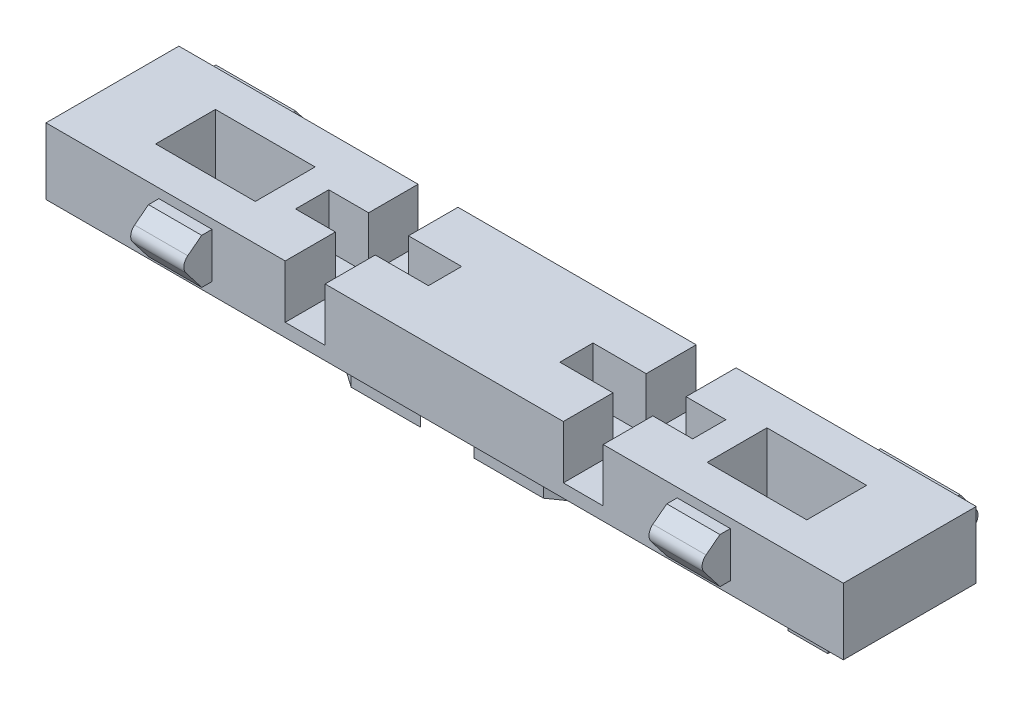
from build123d import *

# Parameters (mm, degrees)
SKETCH2_W             = 60
SKETCH2_H             = 10
SKETCH2_W_2           = 7.5
SKETCH2_H_2           = 4.5
BOSS_EXTRUDE2_DEPTH   = 5
BOSS_EXTRUDE5_DEPTH   = 60
BOSS_EXTRUDE5_2_DEPTH = 60
SKETCH7_W             = 2
SKETCH7_H             = 5
SKETCH7_W_2           = 44
CUT_EXTRUDE1_DEPTH    = 13
SKETCH8_W             = 8.5
SKETCH8_H             = 5
SKETCH8_W_2           = 35
CUT_EXTRUDE2_DEPTH    = 13
CUT_EXTRUDE3_DEPTH    = 4
CUT_EXTRUDE4_DEPTH    = 4
SKETCH11_W            = 2.607558909
SKETCH11_H            = 2.607558909
SKETCH11_W_2          = 3
SKETCH11_H_2          = 3
BOSS_EXTRUDE6_DEPTH   = 1


with BuildPart() as part:
    # Sketch2 → Boss-Extrude2 (new body)
    with BuildSketch(Plane(origin=(0, 0, 0), x_dir=(1, 0, 0), z_dir=(0, 1, 0))):
        Rectangle(SKETCH2_W, SKETCH2_H)
        with Locations((-20.75, 0)):
            Rectangle(SKETCH2_W_2, SKETCH2_H_2, mode=Mode.SUBTRACT)
        with Locations((20.75, 0)):
            Rectangle(SKETCH2_W_2, SKETCH2_H_2, mode=Mode.SUBTRACT)
    extrude(amount=BOSS_EXTRUDE2_DEPTH)

    # Sketch9 → Cut-Extrude3 (cut)
    with BuildSketch(Plane(origin=(0, 5, 0), x_dir=(1, 0, 0), z_dir=(0, 1, 0))):
        Polygon((11.928979033, 5.223704971), (8.928979033, 5.223704971), (8.928979033, 1.234800062), (4.928979033, 1.234800062), (4.928979033, -1.265199938), (8.928979033, -1.265199938), (8.928979033, -5.015199938), (11.928979033, -5.015199938), (11.928979033, -1.265199938), (14.928979033, -1.265199938), (14.928979033, 1.234800062), (11.928979033, 1.234800062), align=None)
    extrude(amount=-CUT_EXTRUDE3_DEPTH, mode=Mode.SUBTRACT)

    # Sketch10 → Cut-Extrude4 (cut)
    with BuildSketch(Plane(origin=(0, 5, 0), x_dir=(1, 0, 0), z_dir=(0, 1, 0))):
        Polygon((-8.998853084, 5.543958906), (-11.998853084, 5.543958906), (-11.998853084, 1.276052018), (-14.998853084, 1.276052018), (-14.998853084, -1.223947982), (-11.998853084, -1.223947982), (-11.998853084, -5.457260258), (-8.998853084, -5.457260258), (-8.998853084, -1.223947982), (-4.998853084, -1.223947982), (-4.998853084, 1.276052018), (-8.998853084, 1.276052018), align=None)
    extrude(amount=-CUT_EXTRUDE4_DEPTH, mode=Mode.SUBTRACT)

    # Sketch11 → Boss-Extrude6 (add)
    with BuildSketch(Plane.XZ):
        Polygon((-17.057761592, 2.305867808), (-12.605307979, 1.026631968), (-7.28914587, 4.747975962), (-2.057761592, 4.747975962), (-12.057761592, -2.252024038), (-17.057761592, -1.002024038), align=None)
        with Locations((-25.931804893, 2.543124907)):
            Rectangle(SKETCH11_W, SKETCH11_H)
        Polygon((11.942238408, -2.252024038), (16.942238408, -0.815500601), (16.942238408, 2.305867808), (12.489784794, 1.026631968), (7.173622685, 4.747975962), (1.942238408, 4.747975962), align=None)
        with Locations((26.509292135, 2.680922235)):
            Rectangle(SKETCH11_W_2, SKETCH11_H_2)
    extrude(amount=BOSS_EXTRUDE6_DEPTH)


with BuildPart() as body_2:
    # Sketch6 → Boss-Extrude5 (new body)
    with BuildSketch(Plane(origin=(30, 0, 0), x_dir=(0, 0, -1), z_dir=(1, 0, 0))):
        with BuildLine():
            Line((-5.005702164, 0.91177929), (-5.005702164, 4.311779386))
            Line((-5.005702164, 4.311779386), (-5.786219743, 4.311779386))
            Line((-5.786219743, 4.311779386), (-6.833939918, 3.506406203))
            ThreePointArc((-6.833939918, 3.506406203), (-7.120662065, 3.008016247), (-6.970231619, 2.45306326))
            Line((-6.970231619, 2.45306326), (-5.778742936, 0.91177929))
            Line((-5.778742936, 0.91177929), (-5.005702164, 0.91177929))
        make_face()
    extrude(amount=-BOSS_EXTRUDE5_DEPTH)

    # Sketch8 → Cut-Extrude2 (cut)
    with BuildSketch(Plane.XY.offset(5)):
        with Locations((25.75, 2.5)):
            Rectangle(SKETCH8_W, SKETCH8_H)
        with Locations((0, 2.5)):
            Rectangle(SKETCH8_W_2, SKETCH8_H)
        with Locations((-25.75, 2.5)):
            Rectangle(SKETCH8_W, SKETCH8_H)
    extrude(amount=CUT_EXTRUDE2_DEPTH, mode=Mode.SUBTRACT)


with BuildPart() as body_3:
    # Sketch6 → Boss-Extrude5 2 (new body)
    with BuildSketch(Plane(origin=(30, 0, 0), x_dir=(0, 0, -1), z_dir=(1, 0, 0))):
        with BuildLine():
            Line((5.785355249, 4.375491674), (5.012314477, 4.375491674))
            Line((5.012314477, 4.375491674), (5.012314477, 0.975491579))
            Line((5.012314477, 0.975491579), (5.792832055, 0.975491579))
            Line((5.792832055, 0.975491579), (6.840552231, 1.780864761))
            ThreePointArc((6.840552231, 1.780864761), (7.127274377, 2.279254717), (6.976843932, 2.834207704))
            Line((6.976843932, 2.834207704), (5.785355249, 4.375491674))
        make_face()
    extrude(amount=-BOSS_EXTRUDE5_2_DEPTH)

    # Sketch7 → Cut-Extrude1 (cut)
    with BuildSketch(Plane(origin=(0, 0, -5), x_dir=(-1, 0, 0), z_dir=(0, 0, -1))):
        with Locations((-29, 2.5)):
            Rectangle(SKETCH7_W, SKETCH7_H)
        with Locations((0, 2.5)):
            Rectangle(SKETCH7_W_2, SKETCH7_H)
        with Locations((29, 2.5)):
            Rectangle(SKETCH7_W, SKETCH7_H)
    extrude(amount=CUT_EXTRUDE1_DEPTH, mode=Mode.SUBTRACT)


with BuildPart() as cut_extrude1_piece_1:
    # of the separate pieces the step leaves, piece 1, a body of its own (cut_extrude1_pieces)
    add(body_3.part.solids().sort_by_distance((28, 4.375491674, -5.785355249))[0])


with BuildPart() as cut_extrude1_piece_2:
    # of the separate pieces the step leaves, piece 2, a body of its own (cut_extrude1_pieces)
    add(body_3.part.solids().sort_by_distance((-22, 4.375491674, -5.785355249))[0])


with BuildPart() as cut_extrude2_piece_1:
    # of the separate pieces the step leaves, piece 1, a body of its own (cut_extrude2_pieces)
    add(body_2.part.solids().sort_by_distance((-17.5, 0.91177929, 5.778742936))[0])


with BuildPart() as cut_extrude2_piece_2:
    # of the separate pieces the step leaves, piece 2, a body of its own (cut_extrude2_pieces)
    add(body_2.part.solids().sort_by_distance((21.5, 0.91177929, 5.778742936))[0])


solid = Compound([part.part, cut_extrude1_piece_1.part, cut_extrude1_piece_2.part, cut_extrude2_piece_1.part, cut_extrude2_piece_2.part])
